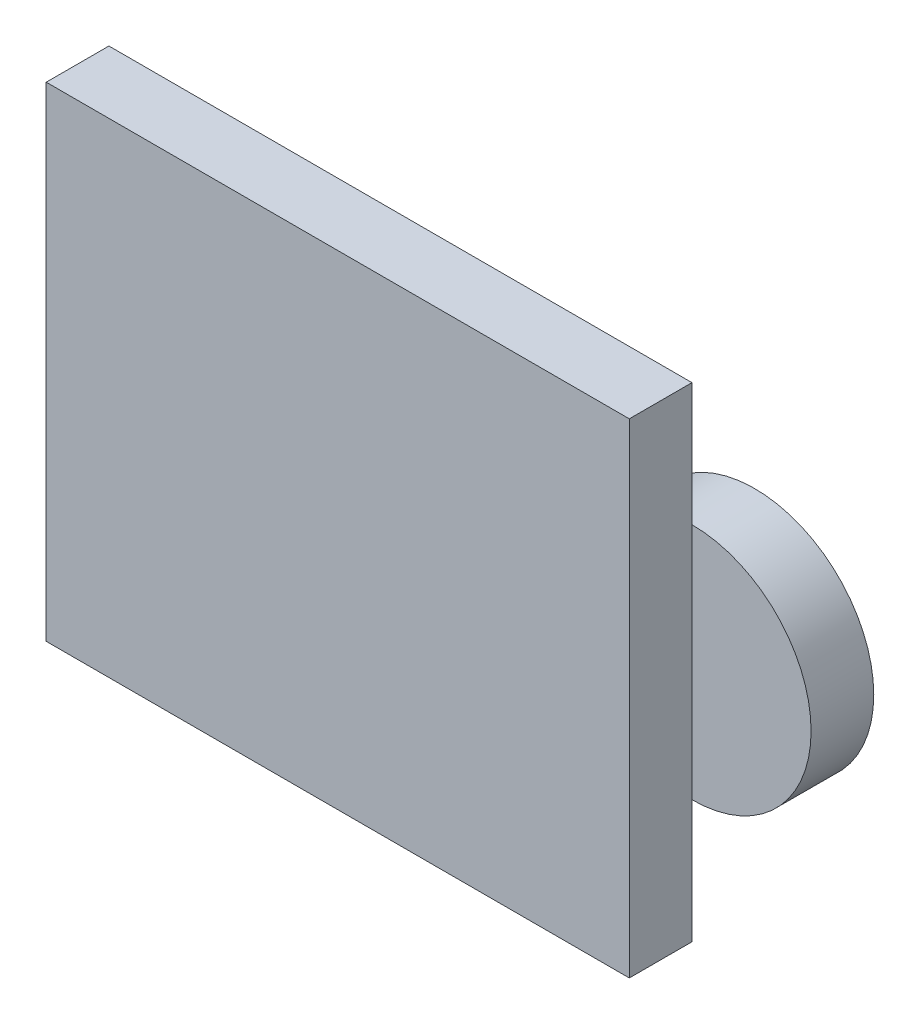
from build123d import *

# Parameters (mm, degrees)
F_1_FR_W        = 93.042145165
F_1_FR_H        = 77.277529207
EXTRUDE_1_DEPTH = 10
SKETCH_2_R      = 19.00858744
EXTRUDE_2_DEPTH = 10


with BuildPart() as part:
    # Эскиз1_fr → Бобышка-Вытянуть1 (new body)
    with BuildSketch(Plane.XY):
        with Locations((-2.472880935, -0.618220234)):
            Rectangle(F_1_FR_W, F_1_FR_H)
    extrude(amount=EXTRUDE_1_DEPTH)

    # Эскиз2 → Бобышка-Вытянуть2 (add)
    with BuildSketch(Plane.XY):
        with Locations((44.048191648, -0.618220234)):
            Circle(SKETCH_2_R)
    extrude(amount=-EXTRUDE_2_DEPTH)


solid = part.part
